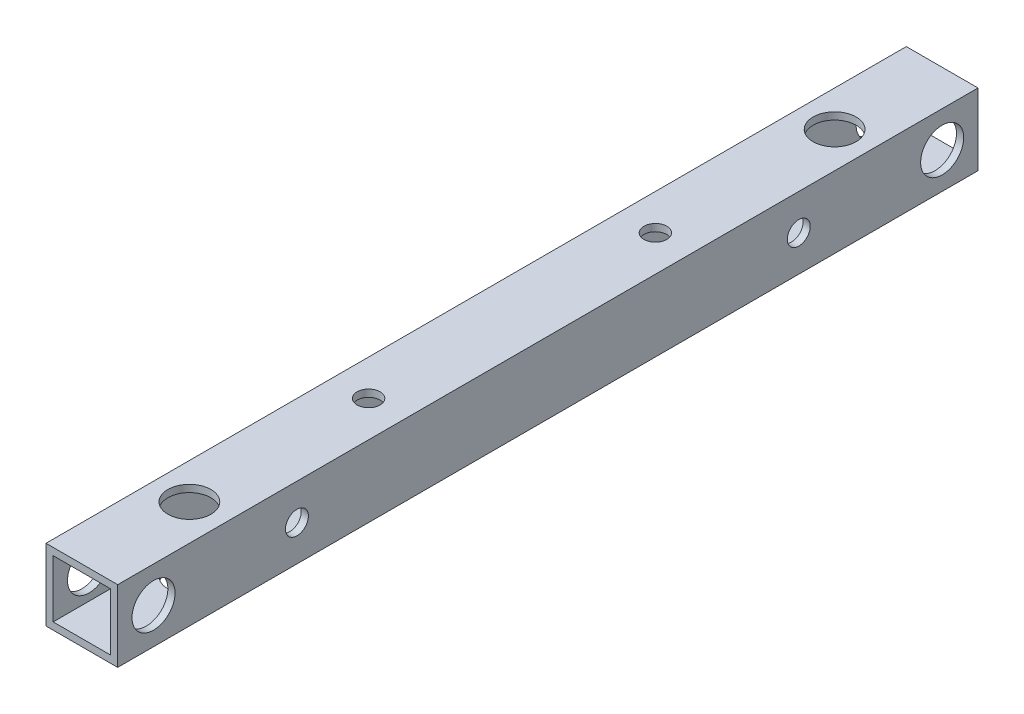
from build123d import *

# Parameters (mm, degrees)
SKETCH_1_W          = 10
SKETCH_1_H          = 10
SKETCH_1_W_2        = 8
SKETCH_1_H_2        = 8
EXTRUDE_1_DEPTH     = 120
SKETCH_2_R          = 3
CUT_EXTRUDE_1_DEPTH = 121.519707932
SKETCH_3_R          = 3
CUT_EXTRUDE_2_DEPTH = 10
SKETCH_4_R          = 1.6
CUT_EXTRUDE_3_DEPTH = 10
SKETCH_5_R          = 1.6
CUT_EXTRUDE_4_DEPTH = 121.519707932
SKETCH_6_R          = 3
CUT_EXTRUDE_5_DEPTH = 2


with BuildPart() as part:
    # ｽｹｯﾁ1 → ﾎﾞｽ - 押し出し1 (new body)
    with BuildSketch(Plane.XY):
        Rectangle(SKETCH_1_W, SKETCH_1_H)
        Rectangle(SKETCH_1_W_2, SKETCH_1_H_2, mode=Mode.SUBTRACT)
    extrude(amount=EXTRUDE_1_DEPTH)

    # ｽｹｯﾁ2 → ｶｯﾄ - 押し出し1 (cut, through all)
    with BuildSketch(Plane.ZY.offset(5)):
        with Locations((5, 0)):
            Circle(SKETCH_2_R)
        with Locations((115, 0)):
            Circle(SKETCH_2_R)
    extrude(amount=-CUT_EXTRUDE_1_DEPTH, mode=Mode.SUBTRACT)

    # ｽｹｯﾁ3 → ｶｯﾄ - 押し出し2 (cut)
    with BuildSketch(Plane(origin=(0, 5, 0), x_dir=(1, 0, 0), z_dir=(0, 1, 0))):
        with Locations(Location((0, -105, 0), (0, 0, 270))):
            Circle(SKETCH_3_R)
        with Locations(Location((0, -15, 0), (0, 0, 270))):
            Circle(SKETCH_3_R)
    extrude(amount=-CUT_EXTRUDE_2_DEPTH, mode=Mode.SUBTRACT)

    # ｽｹｯﾁ4 → ｶｯﾄ - 押し出し3 (cut)
    with BuildSketch(Plane(origin=(0, 5, 0), x_dir=(1, 0, 0), z_dir=(0, 1, 0))):
        with Locations(Location((0, -40, 0), (0, 0, 270))):
            Circle(SKETCH_4_R)
        with Locations(Location((0, -80, 0), (0, 0, 270))):
            Circle(SKETCH_4_R)
    extrude(amount=-CUT_EXTRUDE_3_DEPTH, mode=Mode.SUBTRACT)

    # ｽｹｯﾁ5 → ｶｯﾄ - 押し出し4 (cut, through all)
    with BuildSketch(Plane.ZY.offset(5)):
        with Locations((25, 0)):
            Circle(SKETCH_5_R)
        with Locations((95, 0)):
            Circle(SKETCH_5_R)
    extrude(amount=-CUT_EXTRUDE_4_DEPTH, mode=Mode.SUBTRACT)

    # ｽｹｯﾁ6 → ｶｯﾄ - 押し出し5 (cut)
    with BuildSketch(Plane(origin=(0, -5, 0), x_dir=(-1, 0, 0), z_dir=(0, -1, 0))):
        with Locations(Location((0, -40, 0), (0, 0, 90))):
            Circle(SKETCH_6_R)
        with Locations(Location((0, -80, 0), (0, 0, 90))):
            Circle(SKETCH_6_R)
    extrude(amount=-CUT_EXTRUDE_5_DEPTH, mode=Mode.SUBTRACT)


solid = part.part
